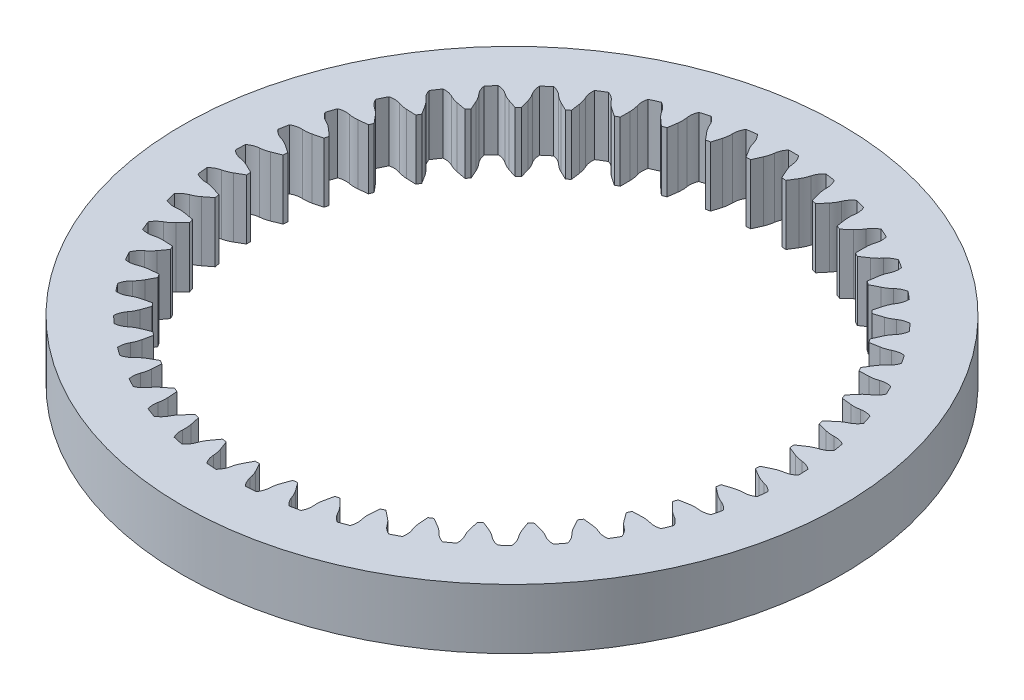
from build123d import *

# Parameters (mm, degrees)
CROQUIS2_R              = 55
CROQUIS2_R_2            = 42.5
SALIENTE_EXTRUIR1_DEPTH = 10
CORTAR_EXTRUIR2_START   = -10
CORTAR_EXTRUIR2_DEPTH   = 10
MATRIZC2_COUNT          = 45


with BuildPart() as part:
    # Croquis2 → Saliente-Extruir1 (new body)
    with BuildSketch(Plane(origin=(0, 0, 0), x_dir=(1, 0, 0), z_dir=(0, 1, 0))):
        with Locations(Location((0, 0, 0), (0, 0, 270))):
            Circle(CROQUIS2_R)
        with Locations(Location((0, 0, 0), (0, 0, 270))):
            Circle(CROQUIS2_R_2, mode=Mode.SUBTRACT)
    extrude(amount=SALIENTE_EXTRUIR1_DEPTH)

    # Croquis4 → Cortar-Extruir2 (cut)
    with BuildSketch(Plane(origin=(0, 10, 0), x_dir=(1, 0, 0), z_dir=(0, 1, 0)).offset(CORTAR_EXTRUIR2_START)):
        with BuildLine():
            Line((-1.94632679, 43.891129002), (-2.601098666, 42.420328685))
            ThreePointArc((-2.601098666, 42.420328685), (0, 42.5), (2.601098666, 42.420328685))
            Line((2.601098666, 42.420328685), (1.94632679, 43.891129002))
            ThreePointArc((1.94632679, 43.891129002), (1.692665559, 44.600458886), (1.548450328, 45.33984706))
            ThreePointArc((1.548450328, 45.33984706), (1.312232202, 46.218532264), (0.834000031, 46.992599885))
            ThreePointArc((0.834000031, 46.992599885), (0, 47), (-0.834000031, 46.992599885))
            ThreePointArc((-0.834000031, 46.992599885), (-1.312232202, 46.218532264), (-1.548450328, 45.33984706))
            ThreePointArc((-1.548450328, 45.33984706), (-1.692665559, 44.600458886), (-1.94632679, 43.891129002))
        make_face()
    cortar_extruir2 = extrude(amount=CORTAR_EXTRUIR2_DEPTH, mode=Mode.SUBTRACT)

    # MatrizC2: Cortar-Extruir2 ×45 about axis
    matrizc2_axis = Axis((0, 0, 0), (0, 1, 0))
    for i in range(1, MATRIZC2_COUNT):
        add(cortar_extruir2.rotate(matrizc2_axis, i * 360 / MATRIZC2_COUNT), mode=Mode.SUBTRACT)


solid = part.part
